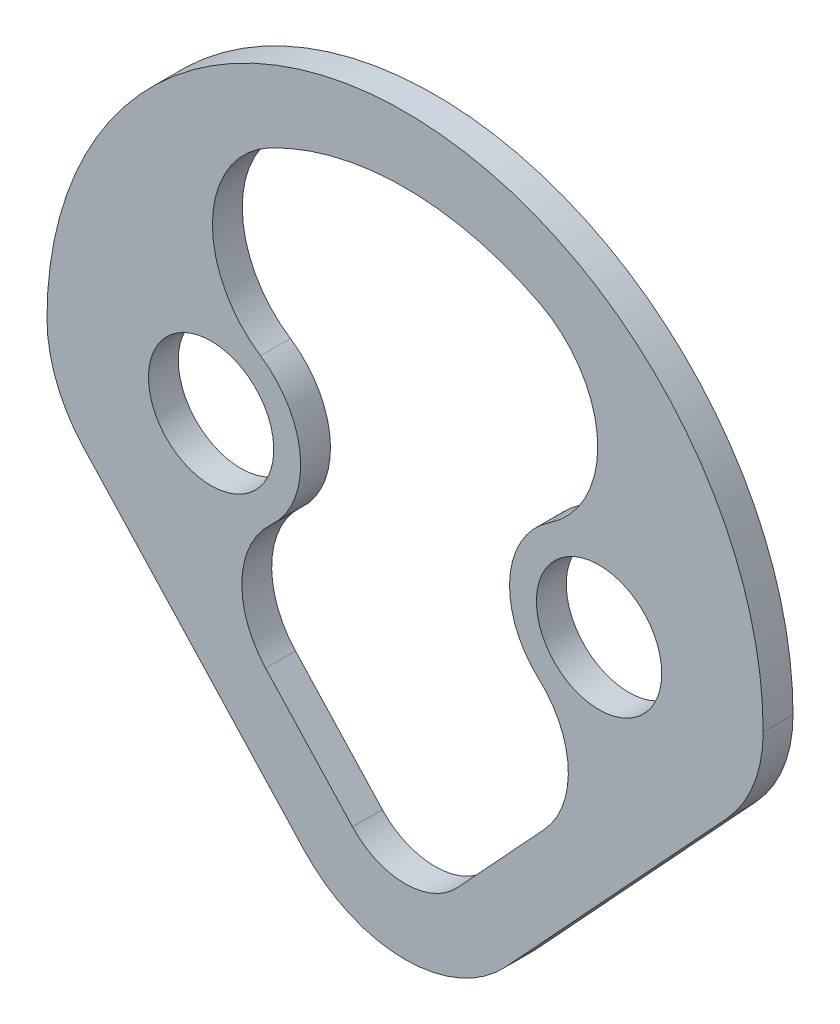
from build123d import *

# Parameters (mm, degrees)
SKETCH2_R           = 10.5
BOSS_EXTRUDE1_DEPTH = 5


with BuildPart() as part:
    # Sketch2 → Boss-Extrude1 (new body)
    with BuildSketch(Plane.XY):
        with BuildLine():
            Line((53.88428711, 24.382034423), (16.88428711, -15.617965577))
            ThreePointArc((16.88428711, -15.617965577), (0, -23), (-16.88428711, -15.617965577))
            Line((-16.88428711, -15.617965577), (-53.88428711, 24.382034423))
            ThreePointArc((-53.88428711, 24.382034423), (-58.416566059, 31.613660022), (-60, 40))
            ThreePointArc((-60, 40), (0, 100), (60, 40))
            ThreePointArc((60, 40), (58.416566059, 31.613660022), (53.88428711, 24.382034423))
        make_face()
        with Locations((32.5, 40)):
            Circle(SKETCH2_R, mode=Mode.SUBTRACT)
        with Locations(Location((-32.5, 40, 0), (0, 0, 180))):
            Circle(SKETCH2_R, mode=Mode.SUBTRACT)
        with BuildLine():
            Line((8.809193275, -8.148503779), (23.364034903, 7.586460143))
            ThreePointArc((23.364034903, 7.586460143), (27.338026386, 18.431860253), (22.426271655, 28.886044933))
            ThreePointArc((22.426271655, 28.886044933), (17.542994151, 41.134890312), (24.218531469, 52.506689369))
            ThreePointArc((24.218531469, 52.506689369), (32.255432897, 68.469423949), (22.572828784, 83.491003675))
            ThreePointArc((22.572828784, 83.491003675), (0, 89), (-22.572828784, 83.491003675))
            ThreePointArc((-22.572828784, 83.491003675), (-32.255432897, 68.469423949), (-24.218531469, 52.506689369))
            ThreePointArc((-24.218531469, 52.506689369), (-17.542994151, 41.134890312), (-22.426271655, 28.886044933))
            ThreePointArc((-22.426271655, 28.886044933), (-27.338026386, 18.431860253), (-23.364034903, 7.586460143))
            Line((-23.364034903, 7.586460143), (-8.809193275, -8.148503779))
            ThreePointArc((-8.809193275, -8.148503779), (0, -12), (8.809193275, -8.148503779))
        make_face(mode=Mode.SUBTRACT)
    extrude(amount=BOSS_EXTRUDE1_DEPTH)


solid = part.part
